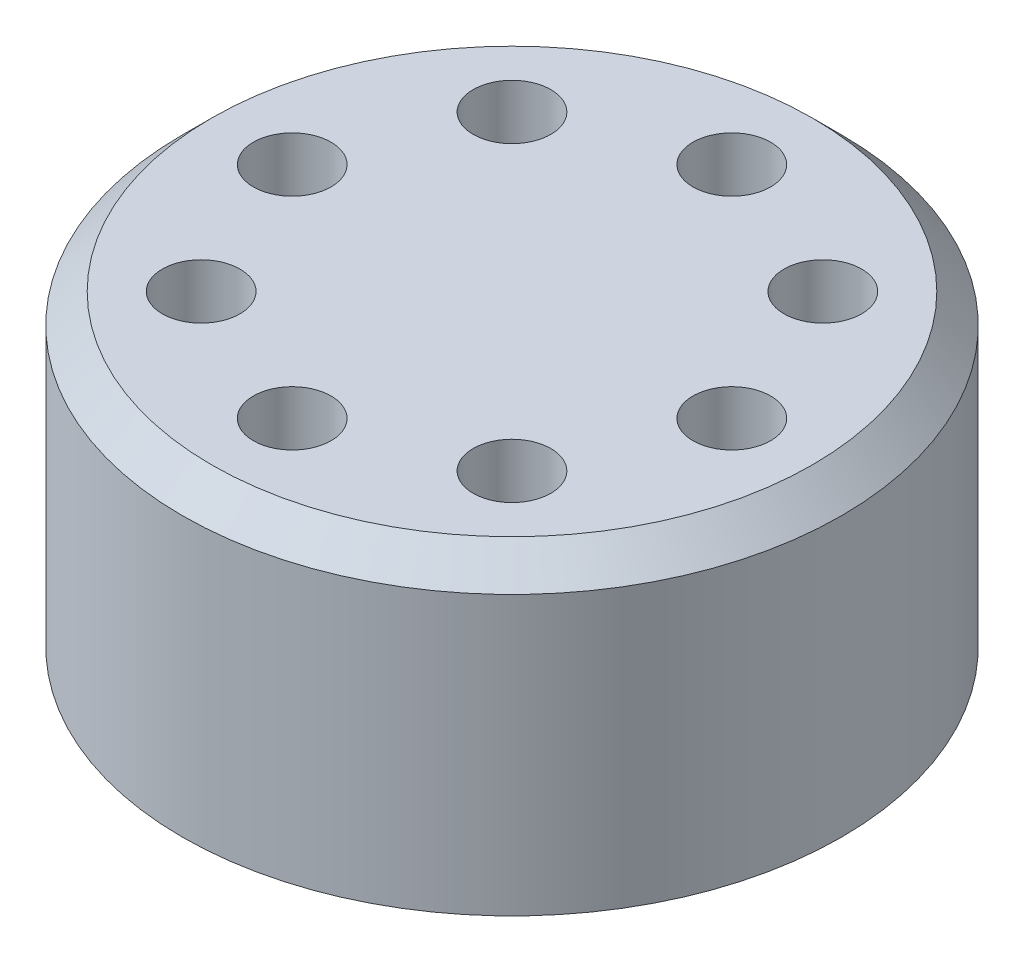
from build123d import *

# Parameters (mm, degrees)
SKETCH1_R            = 22.5
BOSS_EXTRUDE1_DEPTH  = 21
CHAMFER1_SIZE        = 2
M5_CLEARANCE_HOLE1_D = 5.3


with BuildPart() as part:
    # Sketch1 → Boss-Extrude1 (new body)
    with BuildSketch(Plane(origin=(0, 0, 0), x_dir=(1, 0, 0), z_dir=(0, 1, 0))):
        with Locations(Location((0, 0, 0), (0, 0, 90))):
            Circle(SKETCH1_R)
    extrude(amount=BOSS_EXTRUDE1_DEPTH)

    # Chamfer1
    chamfer1_edges = [part.edges().sort_by_distance(p)[0] for p in [
        (0, 21, 22.5),
    ]]
    chamfer(chamfer1_edges, length=CHAMFER1_SIZE)

    # M5 Clearance Hole1 (through all)
    with Locations(Plane(origin=(0, 21, 0), x_dir=(1, 0, 0), z_dir=(0, 1, 0))):
        with Locations((-10.606601718, 10.606601718), (0, 15), (15, 0), (0, -15), (-15, 0), (10.606601718, 10.606601718), (10.606601718, -10.606601718), (-10.606601718, -10.606601718)):
            Hole(M5_CLEARANCE_HOLE1_D / 2)


solid = part.part
